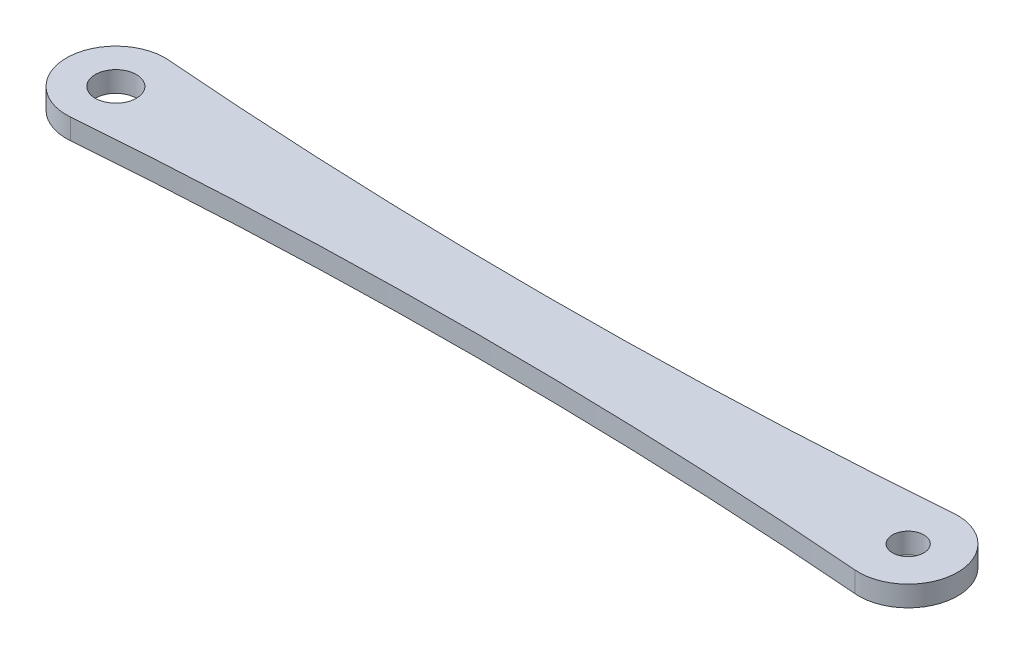
from build123d import *

# Parameters (mm, degrees)
SKETCH1_R           = 3.175
SKETCH1_R_2         = 2.413
BOSS_EXTRUDE1_DEPTH = 3.175


with BuildPart() as part:
    # Sketch1 → Boss-Extrude1 (new body)
    with BuildSketch(Plane(origin=(0, 0, 0), x_dir=(1, 0, 0), z_dir=(0, 1, 0))):
        with BuildLine():
            ThreePointArc((0.605385197, 7.595913952), (-7.62, 0), (0.605385197, -7.595913952))
            ThreePointArc((0.605385197, -7.595913952), (61.14390489, -5.187309133), (121.682424583, -7.595913952))
            ThreePointArc((121.682424583, -7.595913952), (129.90780978, 0), (121.682424583, 7.595913952))
            ThreePointArc((121.682424583, 7.595913952), (61.14390489, 5.187309133), (0.605385197, 7.595913952))
        make_face()
        with Locations(Location((0, 0, 0), (0, 0, 270))):
            Circle(SKETCH1_R, mode=Mode.SUBTRACT)
        with Locations(Location((122.28780978, 0, 0), (0, 0, 270))):
            Circle(SKETCH1_R_2, mode=Mode.SUBTRACT)
    extrude(amount=BOSS_EXTRUDE1_DEPTH)


solid = part.part
